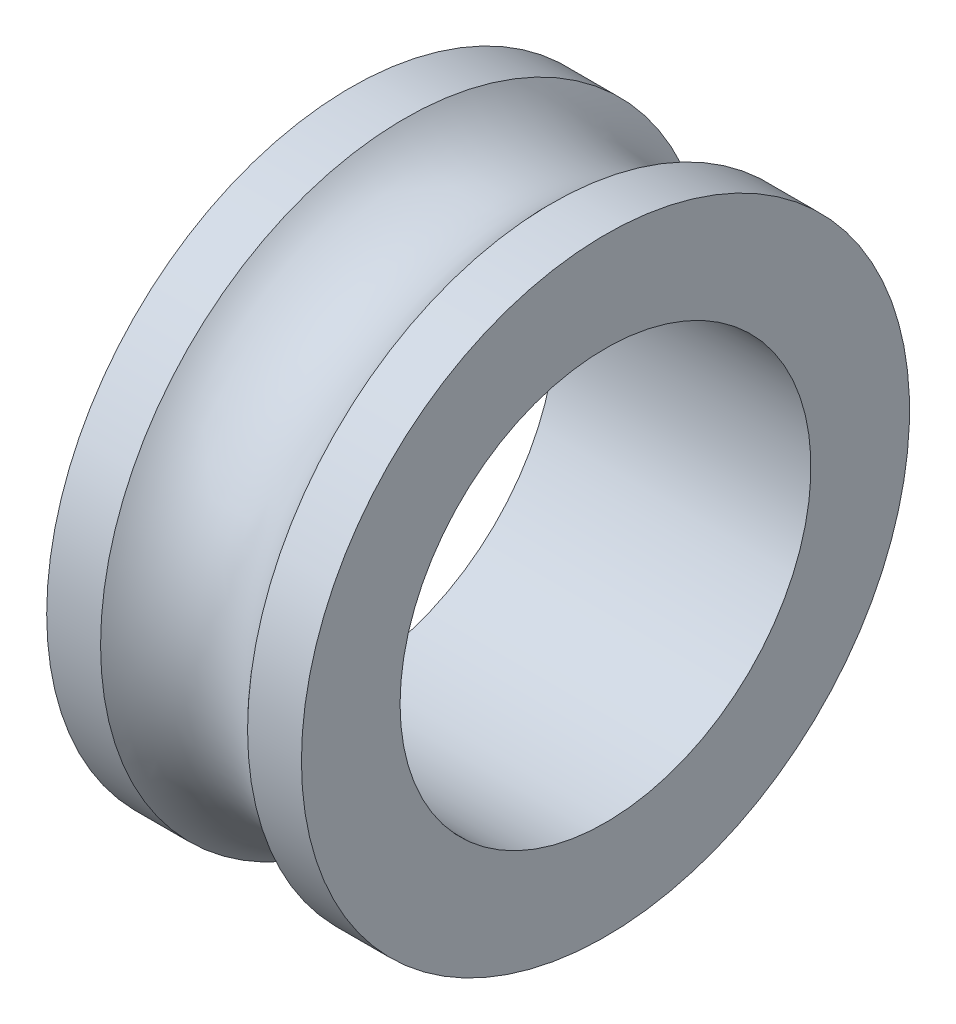
from build123d import *


with BuildPart() as part:
    # Sketch1 → Revolve1 (revolve)
    with BuildSketch(Plane.XY, mode=Mode.PRIVATE) as revolve1_sk:
        with BuildLine():
            Line((-15.5, 37), (-8.94427191, 37))
            ThreePointArc((-8.94427191, 37), (0, 33), (8.94427191, 37))
            Line((8.94427191, 37), (15.5, 37))
            Line((15.5, 37), (15.5, 25))
            Line((15.5, 25), (-15.5, 25))
            Line((-15.5, 25), (-15.5, 37))
        make_face()
    revolve(revolve1_sk.sketch.rotate(Axis((-15.5, 0, 0), (1, 0, 0)), 90), axis=Axis((-15.5, 0, 0), (1, 0, 0)))


solid = part.part
